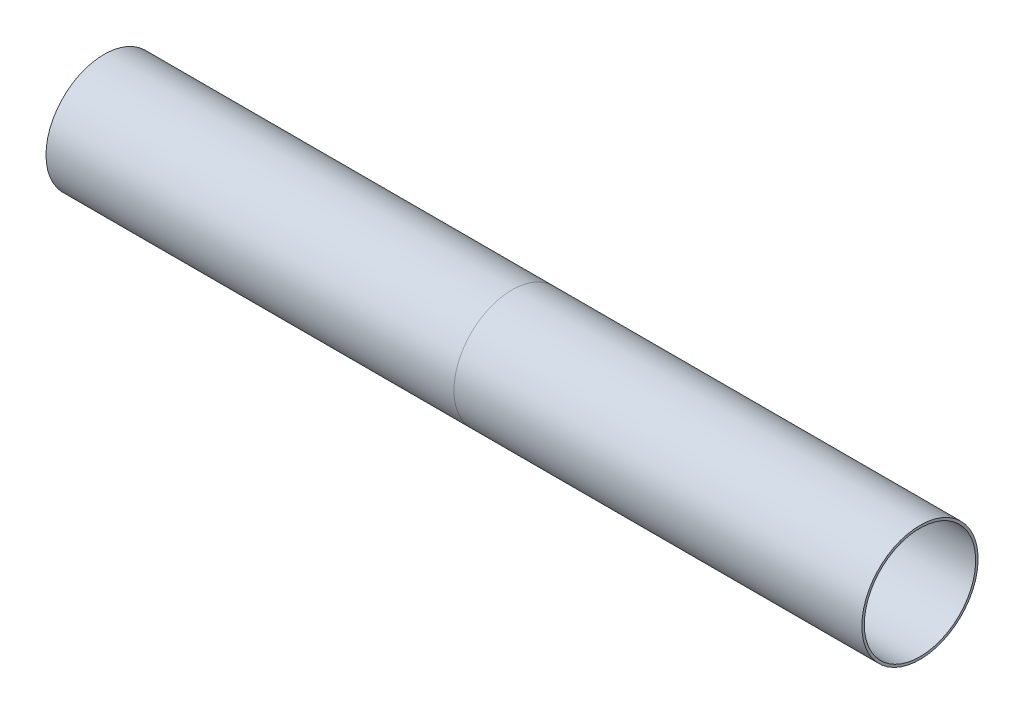
from build123d import *


with BuildPart() as part:
    # Sketch2 → Revolve1 (revolve)
    with BuildSketch(Plane(origin=(0, 0, 0), x_dir=(1, 0, 0), z_dir=(0, 1, 0))):
        Polygon((200, 27.3), (200, 28.5), (0, 28.5), (0, 27.3), (11.430052303, 26.3), (12.430052303, 27.3), align=None)
    revolve(axis=Axis((0, 0, 0), (1, 0, 0)))


with BuildPart() as body_2:
    # Sketch2<3> → Revolve2 (revolve)
    with BuildSketch(Plane(origin=(0, 0, 0), x_dir=(1, 0, 0), z_dir=(0, 1, 0))):
        Polygon((0, 27.3), (0, 28.5), (-200, 28.5), (-200, 27.3), (-188.569947697, 26.3), (-187.569947697, 27.3), (-12.430052303, 27.3), (-11.430052303, 26.3), align=None)
    revolve(axis=Axis((0, 0, 0), (1, 0, 0)))


with BuildPart() as body_3:
    # Sketch3 → Revolve3 (revolve)
    with BuildSketch(Plane(origin=(0, 0, 0), x_dir=(1, 0, 0), z_dir=(0, 1, 0))):
        Polygon((-11.430052303, 26.3), (0, 27.3), (11.430052303, 26.3), (11.430052303, 25.1), (-11.430052303, 25.1), align=None)
    revolve(axis=Axis((0, 0, 0), (1, 0, 0)))


solid = Compound([part.part, body_2.part, body_3.part])
